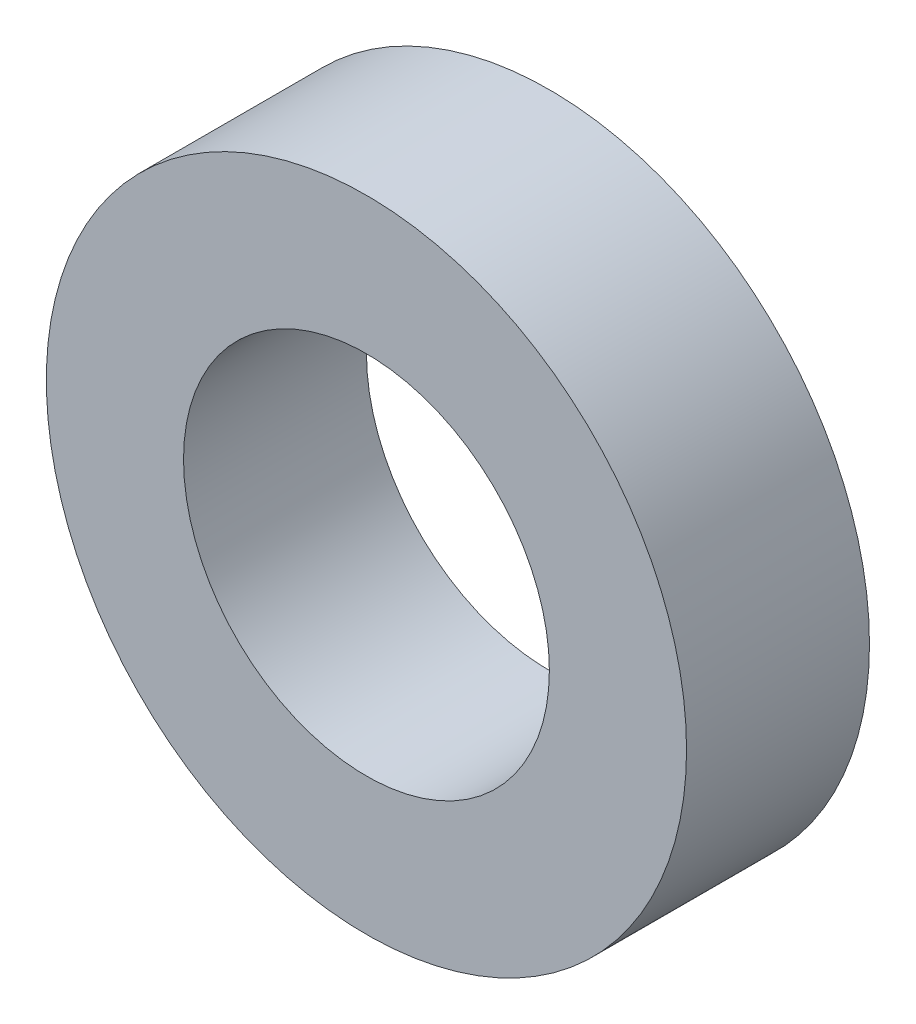
from build123d import *

# Parameters (mm, degrees)
SKETCH_1_R      = 17.5
SKETCH_1_R_2    = 10
EXTRUDE_1_DEPTH = 10


with BuildPart() as part:
    # 草图1 → 凸台-拉伸1 (new body)
    with BuildSketch(Plane.XY):
        Circle(SKETCH_1_R)
        Circle(SKETCH_1_R_2, mode=Mode.SUBTRACT)
    extrude(amount=EXTRUDE_1_DEPTH)


solid = part.part
